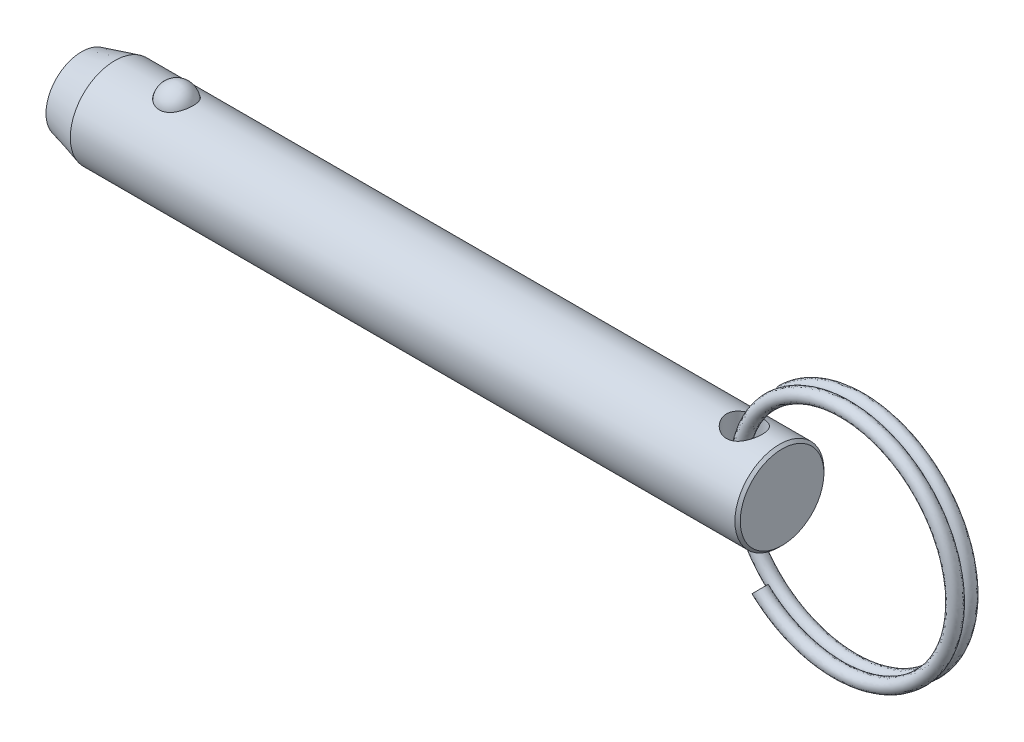
from build123d import *

# Parameters (mm, degrees)
SKETCH4_W          = 2.54
SKETCH4_H          = 12.7
SWEEP1_PITCH       = 1.9304
SWEEP1_HEIGHT      = 1.6891
SWEEP1_RADIUS      = 16.8275
SKETCH6_R          = 0.9525
SWEEP2_PITCH       = 1.9304
SWEEP2_HEIGHT      = 1.6891
SWEEP2_RADIUS      = 16.8275
SWEEP2_START_ANGLE = -180
SKETCH6_2_R        = 0.9525


with BuildPart() as part:
    # Sketch1 → Revolve1 (revolve)
    with BuildSketch(Plane.XY, mode=Mode.PRIVATE) as revolve1_sk:
        Polygon((7.9248, 5.969), (7.5438, 6.35), (-87.335295474, 6.35), (-92.075, 5.08), (-92.075, 0), (7.9248, 0), align=None)
    revolve(revolve1_sk.sketch.rotate(Axis((7.9248, 0, 0), (1, 0, 0)), 90), axis=Axis((7.9248, 0, 0), (1, 0, 0)))

    # Sketch2 → Cut-Revolve1 (revolve, cut)
    with BuildSketch(Plane.XY):
        with BuildLine():
            Line((-76.089548453, 5.715), (-80.966348453, 5.715))
            ThreePointArc((-80.966348453, 5.715), (-78.527948453, 8.1534), (-76.089548453, 5.715))
        make_face()
    revolve(axis=Axis((-76.089548453, 5.715, 0), (1, 0, 0)), mode=Mode.SUBTRACT)

    # Sketch4 → Cut-Revolve2 (revolve, cut)
    with BuildSketch(Plane.XY, mode=Mode.PRIVATE) as cut_revolve2_sk:
        with Locations((3.81, 0)):
            Rectangle(SKETCH4_W, SKETCH4_H)
    revolve(cut_revolve2_sk.sketch.rotate(Axis((2.54, -6.35, 0), (0, 1, 0)), 90), axis=Axis((2.54, -6.35, 0), (0, 1, 0)), mode=Mode.SUBTRACT)


with BuildPart() as body_2:
    # Sketch3 → Revolve2 (revolve)
    with BuildSketch(Plane.XY):
        with BuildLine():
            Line((-76.114948453, 5.715), (-80.940948453, 5.715))
            ThreePointArc((-80.940948453, 5.715), (-78.527948453, 8.128), (-76.114948453, 5.715))
        make_face()
    revolve(axis=Axis((-76.114948453, 5.715, 0), (1, 0, 0)))


with BuildPart() as body_3:
    # Sweep1: sweep along a helix
    with BuildLine() as sweep1_path:
        Helix(SWEEP1_PITCH, SWEEP1_HEIGHT, SWEEP1_RADIUS, center=(17.705759076, 0, 0), direction=(0, 0, -1), lefthand=True)
    # Sketch6 → Sweep1 (sweep)
    with BuildSketch(Plane(origin=(114.003847968, 0, 0), x_dir=(0, 0, -1), z_dir=(0, 1, 0))):
        with Locations((0, 112.173088892)):
            Circle(SKETCH6_R)
    sweep(path=sweep1_path.line, is_frenet=True)

    # Sweep2: sweep along a helix
    with BuildLine() as sweep2_path:
        add(Helix(SWEEP2_PITCH, SWEEP2_HEIGHT, SWEEP2_RADIUS, center=(17.705759076, 0, 0), direction=(0, 0, 1), lefthand=True, mode=Mode.PRIVATE).rotate(Axis((17.705759076, 0, 0), (0, 0, 1)), SWEEP2_START_ANGLE))
    # Sketch6<2> → Sweep2 (sweep)
    with BuildSketch(Plane(origin=(114.003847968, 0, 0), x_dir=(0, 0, -1), z_dir=(0, 1, 0))):
        with Locations((0, 112.173088892)):
            Circle(SKETCH6_2_R)
    sweep(path=sweep2_path.line, is_frenet=True)


solid = Compound([part.part, body_2.part, body_3.part])
